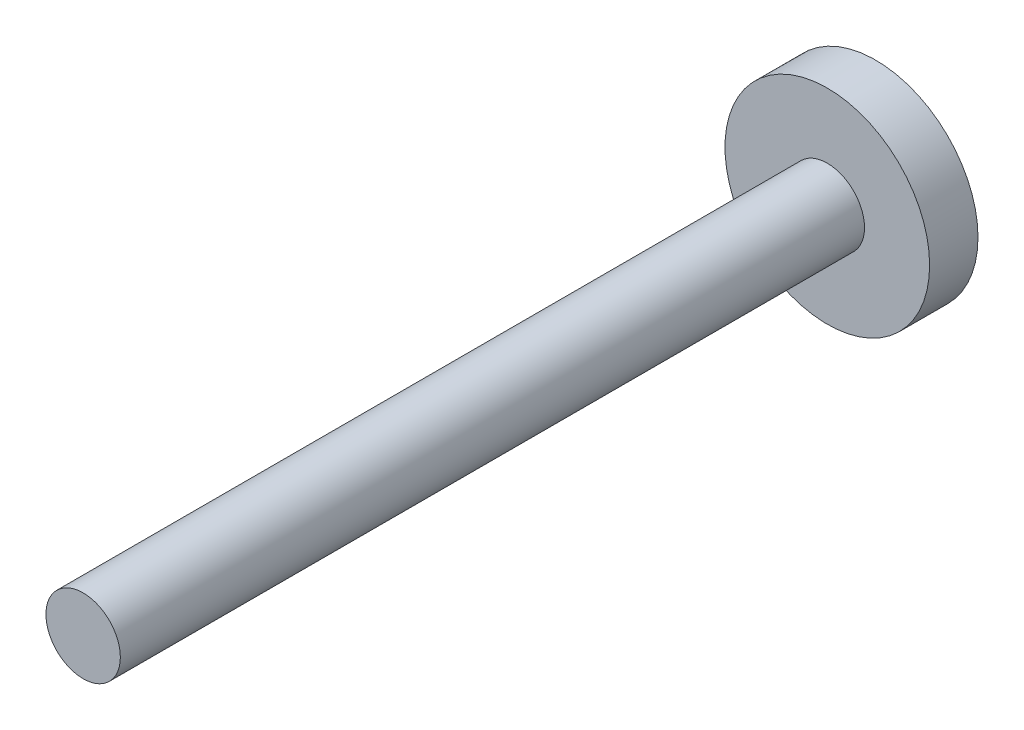
from build123d import *

# Parameters (mm, degrees)
ESQUISSE1_R        = 1
BOSS_EXTRU_1_DEPTH = 20
ESQUISSE2_R        = 2.75
BOSS_EXTRU_2_DEPTH = 1.3


with BuildPart() as part:
    # Esquisse1 → Boss.-Extru.1 (new body)
    with BuildSketch(Plane.XY):
        Circle(ESQUISSE1_R)
    extrude(amount=BOSS_EXTRU_1_DEPTH)

    # Esquisse2 → Boss.-Extru.2 (add)
    with BuildSketch(Plane.XY):
        Circle(ESQUISSE2_R)
    extrude(amount=-BOSS_EXTRU_2_DEPTH)


solid = part.part
